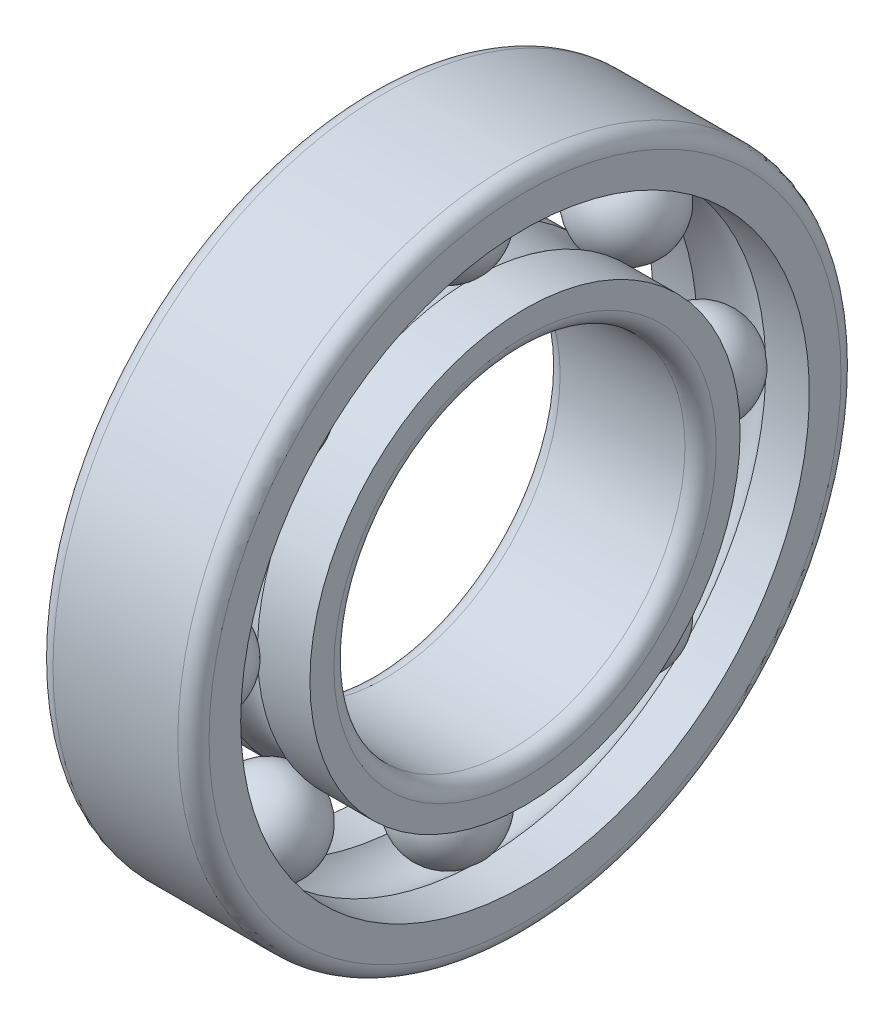
from build123d import *

# Parameters (mm, degrees)
NBR_DE_BILLES_COUNT = 8


with BuildPart() as part:
    # Esquisse1 → Bague int (revolve)
    with BuildSketch(Plane.XY):
        with BuildLine():
            Line((2, 5.513806706), (0.654166625, 5.513806706))
            ThreePointArc((0.654166625, 5.513806706), (0, 5.316568047), (-0.654166625, 5.513806706))
            Line((-0.654166625, 5.513806706), (-2, 5.513806706))
            Line((-2, 5.513806706), (-2, 4.9))
            ThreePointArc((-2, 4.9), (-1.882842712, 4.617157288), (-1.6, 4.5))
            Line((-1.6, 4.5), (1.6, 4.5))
            ThreePointArc((1.6, 4.5), (1.882842712, 4.617157288), (2, 4.9))
            Line((2, 4.9), (2, 5.513806706))
        make_face()
    revolve(axis=Axis((5, 0, 0), (-1, 0, 0)))

    # Esquisse3 → Bille (revolve)
    with BuildSketch(Plane.XY):
        with BuildLine():
            Line((-1.208431953, 6.5), (1.208431953, 6.5))
            ThreePointArc((1.208431953, 6.5), (0, 5.291568047), (-1.208431953, 6.5))
        make_face()
    bille = revolve(axis=Axis((-6.749183074, 6.5, 0), (1, 0, 0)))

    # Esquisse2 → Bague ext (revolve)
    with BuildSketch(Plane.XY):
        with BuildLine():
            Line((-1.6, 8.5), (1.6, 8.5))
            ThreePointArc((1.6, 8.5), (1.882842712, 8.382842712), (2, 8.1))
            Line((2, 8.1), (2, 7.288954635))
            Line((2, 7.288954635), (0.882078098, 7.288954635))
            ThreePointArc((0.882078098, 7.288954635), (0, 7.683431953), (-0.882078098, 7.288954635))
            Line((-0.882078098, 7.288954635), (-2, 7.288954635))
            Line((-2, 7.288954635), (-2, 8.1))
            ThreePointArc((-2, 8.1), (-1.882842712, 8.382842712), (-1.6, 8.5))
        make_face()
    revolve(axis=Axis((-5, 0, 0), (1, 0, 0)))

    # Nbr de billes: Bille ×8 about axis
    nbr_de_billes_axis = Axis((-2.2, 0, 0), (1, 0, 0))
    for i in range(1, NBR_DE_BILLES_COUNT):
        add(bille.rotate(nbr_de_billes_axis, i * 360 / NBR_DE_BILLES_COUNT))


solid = part.part
